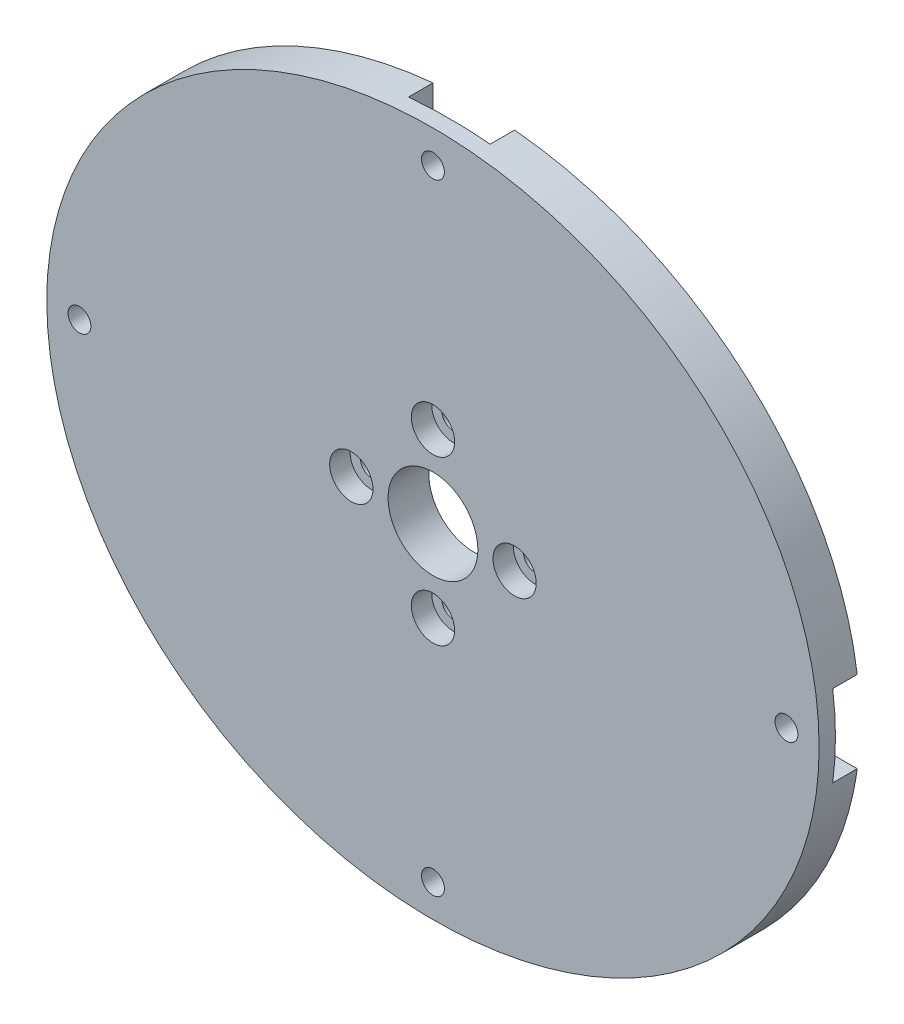
from build123d import *

# Parameters (mm, degrees)
SKETCH1_RX          = 47.3
SKETCH1_RY          = 42
SKETCH1_R           = 5.5
SKETCH1_R_2         = 1.4
BOSS_EXTRUDE1_DEPTH = 5
CUT_EXTRUDE3_START  = -2.5
SKETCH5_R           = 2.65
SKETCH5_R_2         = 1.4
CUT_EXTRUDE3_DEPTH  = 2.5
CUT_EXTRUDE4_DEPTH  = 3


with BuildPart() as part:
    # Sketch1 → Boss-Extrude1 (new body)
    with BuildSketch(Plane.XY):
        with Locations(Location((0, 0), (0, 0, 180))):
            Ellipse(SKETCH1_RX, SKETCH1_RY)
        Circle(SKETCH1_R, mode=Mode.SUBTRACT)
        with Locations((-10, 0)):
            Circle(SKETCH1_R_2, mode=Mode.SUBTRACT)
        with Locations((0, 10)):
            Circle(SKETCH1_R_2, mode=Mode.SUBTRACT)
        with Locations((10, 0)):
            Circle(SKETCH1_R_2, mode=Mode.SUBTRACT)
        with Locations((0, -10)):
            Circle(SKETCH1_R_2, mode=Mode.SUBTRACT)
        with Locations((0, 38)):
            Circle(SKETCH1_R_2, mode=Mode.SUBTRACT)
        with Locations((-43.3, 0)):
            Circle(SKETCH1_R_2, mode=Mode.SUBTRACT)
        with Locations(Location((43.3, 0, 0), (0, 0, 180))):
            Circle(SKETCH1_R_2, mode=Mode.SUBTRACT)
        with Locations(Location((0, -38, 0), (0, 0, 180))):
            Circle(SKETCH1_R_2, mode=Mode.SUBTRACT)
    extrude(amount=BOSS_EXTRUDE1_DEPTH)

    # Sketch5 → Cut-Extrude3 (cut)
    # profile 1 of 4: a face of its own
    with BuildSketch(Plane.XY.offset(5).offset(CUT_EXTRUDE3_START)):
        with Locations((0, 10)):
            Circle(SKETCH5_R)
        with Locations((0, 10)):
            Circle(SKETCH5_R_2, mode=Mode.SUBTRACT)
    # profile 2 of 4: a face of its own
    with BuildSketch(Plane.XY.offset(5).offset(CUT_EXTRUDE3_START)):
        with Locations((10, 0)):
            Circle(SKETCH5_R)
        with Locations((10, 0)):
            Circle(SKETCH5_R_2, mode=Mode.SUBTRACT)
    # profile 3 of 4: a face of its own
    with BuildSketch(Plane.XY.offset(5).offset(CUT_EXTRUDE3_START)):
        with Locations((0, -10)):
            Circle(SKETCH5_R)
        with Locations((0, -10)):
            Circle(SKETCH5_R_2, mode=Mode.SUBTRACT)
    # profile 4 of 4: a face of its own
    with BuildSketch(Plane.XY.offset(5).offset(CUT_EXTRUDE3_START)):
        with Locations((-10, 0)):
            Circle(SKETCH5_R)
        with Locations((-10, 0)):
            Circle(SKETCH5_R_2, mode=Mode.SUBTRACT)
    extrude(amount=CUT_EXTRUDE3_DEPTH, mode=Mode.SUBTRACT)

    # Sketch6 → Cut-Extrude4 (cut)
    with BuildSketch(Plane(origin=(0, 0, 0), x_dir=(-1, 0, 0), z_dir=(0, 0, -1))):
        with BuildLine():
            Line((-5, 41.764681883), (-5, 31.764681883))
            Line((-5, 31.764681883), (5, 31.764681883))
            Line((5, 31.764681883), (5, 41.764681883))
            add(Edge.make_bspline(
                [(5, 41.764681883), (0, 42.236643989), (-5, 41.764681883)],
                knots=[1.464890217, 1.464890217, 1.464890217, 1.676702437, 1.676702437, 1.676702437], degree=2, weights=[1, 0.994397188, 1]))
        make_face()
        with BuildLine():
            Line((-46.963628217, 5), (-36.963628217, 5))
            Line((-36.963628217, 5), (-36.963628217, -5))
            Line((-36.963628217, -5), (-46.963628217, -5))
            add(Edge.make_bspline(
                [(-46.963628217, 5), (-47.638781009, 0), (-46.963628217, -5)],
                knots=[3.022262029, 3.022262029, 3.022262029, 3.260923278, 3.260923278, 3.260923278], degree=2, weights=[1, 0.992888546, 1]))
        make_face()
        with BuildLine():
            Line((46.963628217, 5), (36.963628217, 5))
            Line((36.963628217, 5), (36.963628217, -5))
            Line((36.963628217, -5), (46.963628217, -5))
            add(Edge.make_bspline(
                [(46.963628217, -5), (47.638781009, 0), (46.963628217, 5)],
                knots=[3.022262029, 3.022262029, 3.022262029, 3.260923278, 3.260923278, 3.260923278], degree=2, weights=[1, 0.992888546, 1]))
        make_face()
        with BuildLine():
            Line((5, -31.764681883), (5, -41.764681883))
            add(Edge.make_bspline(
                [(-5, -41.764681883), (0, -42.236643989), (5, -41.764681883)],
                knots=[4.60648287, 4.60648287, 4.60648287, 4.81829509, 4.81829509, 4.81829509], degree=2, weights=[1, 0.994397188, 1]))
            Line((-5, -41.764681883), (-5, -31.764681883))
            Line((-5, -31.764681883), (5, -31.764681883))
        make_face()
    extrude(amount=-CUT_EXTRUDE4_DEPTH, mode=Mode.SUBTRACT)


solid = part.part
